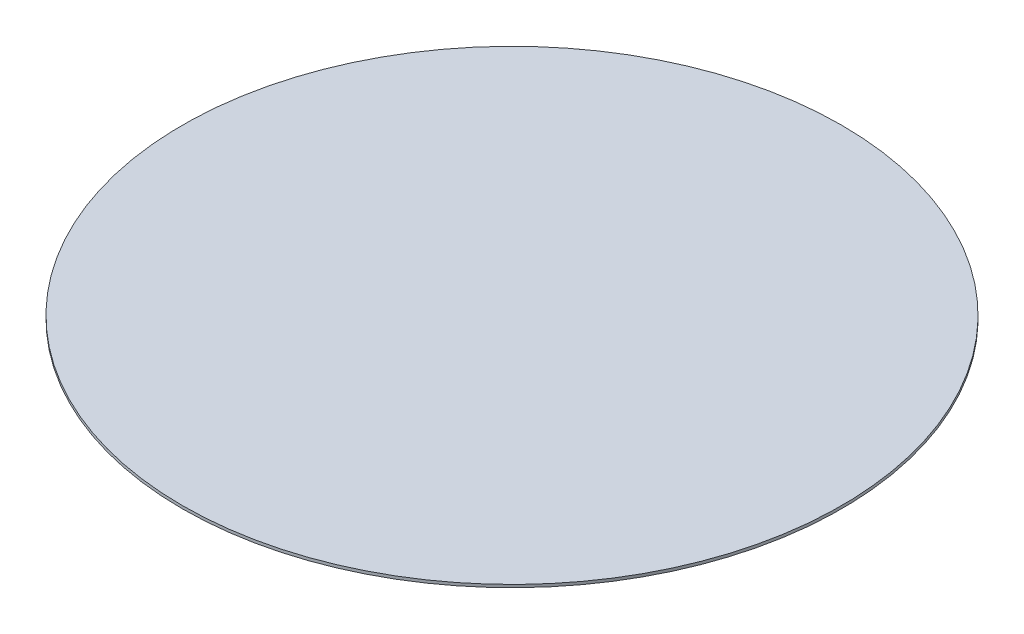
from build123d import *

# Parameters (mm, degrees)
SKETCH1_R           = 1750
BOSS_EXTRUDE1_DEPTH = 15


with BuildPart() as part:
    # Sketch1 → Boss-Extrude1 (new body)
    with BuildSketch(Plane(origin=(0, 0, 0), x_dir=(1, 0, 0), z_dir=(0, 1, 0))):
        with Locations(Location((0, 0, 0), (0, 0, 270))):
            Circle(SKETCH1_R)
    extrude(amount=BOSS_EXTRUDE1_DEPTH)


solid = part.part
